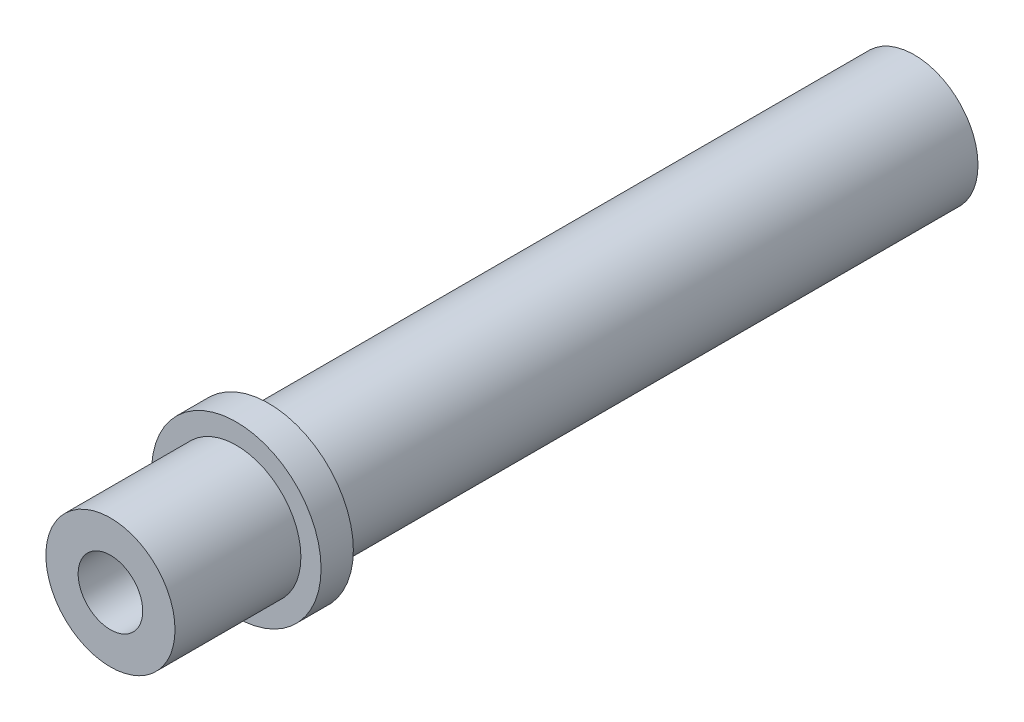
from build123d import *

# Parameters (mm, degrees)
S01_PRINTABLE_SLIDING_PIN_7_90_MM_R            = 3.95
F_01_PRINTABLE_SLIDING_PIN_7_90_MM_DEPTH       = 40
F_02_START                                     = 40
S02_RECESSED_LOAD_SHOULDER_R                   = 5.25
F_02_RECESSED_LOAD_SHOULDER_DEPTH              = 2
F_03_START                                     = 42
S03_LOCATING_PILOT_THROUGH_SWING_ARM_R         = 4
F_03_LOCATING_PILOT_THROUGH_SWING_ARM_DEPTH    = 7.8
F_04_START                                     = 42.6
S04_M3_HEAT_SET_POCKET_IN_SUPPORTED_RO_R       = 2
F_04_M3_HEAT_SET_POCKET_IN_SUPPORTED_ROO_DEPTH = 7.3


with BuildPart() as part:
    # S01 - Printable sliding pin - 7.90 mm → 01 - Printable sliding pin - 7.90 mm (new body)
    with BuildSketch(Plane.XY):
        Circle(S01_PRINTABLE_SLIDING_PIN_7_90_MM_R)
    extrude(amount=F_01_PRINTABLE_SLIDING_PIN_7_90_MM_DEPTH)

    # S02 - Recessed load shoulder → 02 - Recessed load shoulder (add)
    with BuildSketch(Plane.XY.offset(F_02_START)):
        Circle(S02_RECESSED_LOAD_SHOULDER_R)
    extrude(amount=F_02_RECESSED_LOAD_SHOULDER_DEPTH)

    # S03 - Locating pilot through swing arm → 03 - Locating pilot through swing arm (add)
    with BuildSketch(Plane.XY.offset(F_03_START)):
        Circle(S03_LOCATING_PILOT_THROUGH_SWING_ARM_R)
    extrude(amount=F_03_LOCATING_PILOT_THROUGH_SWING_ARM_DEPTH)

    # S04 - M3 heat-set pocket in supported root → 04 - M3 heat-set pocket in supported root (cut)
    with BuildSketch(Plane.XY.offset(F_04_START)):
        Circle(S04_M3_HEAT_SET_POCKET_IN_SUPPORTED_RO_R)
    extrude(amount=F_04_M3_HEAT_SET_POCKET_IN_SUPPORTED_ROO_DEPTH, mode=Mode.SUBTRACT)


solid = part.part
